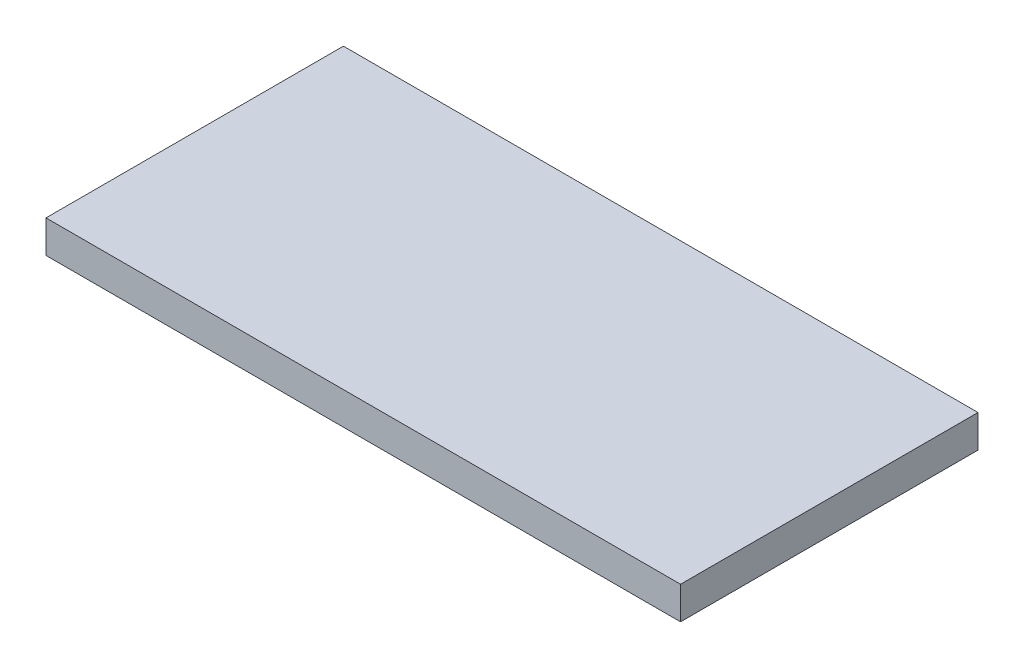
from build123d import *

# Parameters (mm, degrees)
SKETCH_1_W        = 448
SKETCH_1_H        = 210
EXTRUDE_345_DEPTH = 11.5


with BuildPart() as part:
    # ｽｹｯﾁ1 → Extrude 345 (new, symmetric)
    with BuildSketch(Plane(origin=(0, 0, 0), x_dir=(1, 0, 0), z_dir=(0, 1, 0))):
        Rectangle(SKETCH_1_W, SKETCH_1_H)
    extrude(amount=EXTRUDE_345_DEPTH, both=True)


solid = part.part
